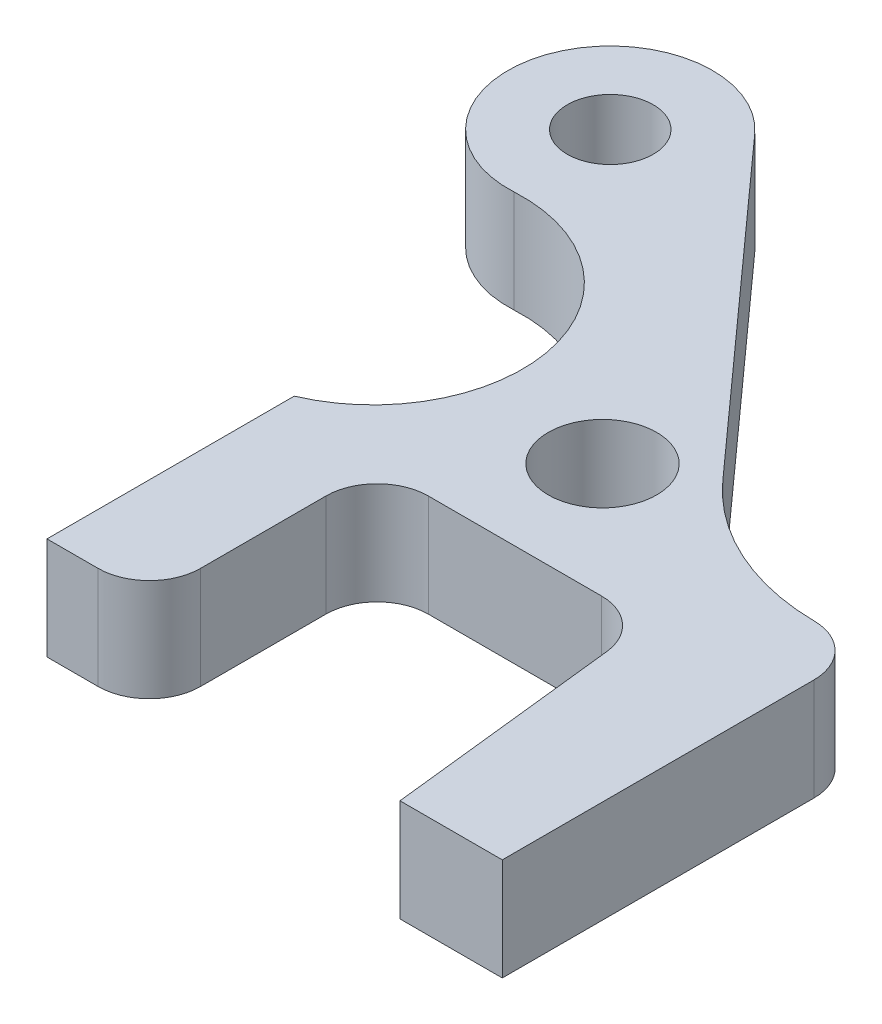
from build123d import *

# Parameters (mm, degrees)
BOSS_EXTRUDE1_DEPTH  = 5
M5_CLEARANCE_HOLE1_D = 5.3
M5_TAPPED_HOLE1_D    = 4.2


with BuildPart() as part:
    # Sketch3 → Boss-Extrude1 (new body)
    with BuildSketch(Plane(origin=(0, 0, 0), x_dir=(-1, 0, 0), z_dir=(0, 1, 0))):
        with BuildLine():
            Line((-3.718320572, -3.342767136), (-17.618374366, 12.118930874))
            ThreePointArc((-17.618374366, 12.118930874), (-21.319064477, 14.826224184), (-25.796067121, 15.816674432))
            ThreePointArc((-25.796067121, 15.816674432), (-27.546375819, 16.558322133), (-28.269100189, 18.316528984))
            Line((-28.269100189, 18.316528984), (-28.269100189, 33.544684312))
            Line((-28.269100189, 33.544684312), (-23.269100189, 33.544684312))
            Line((-23.269100189, 33.544684312), (-22.007395686, 22.177884957))
            ThreePointArc((-22.007395686, 22.177884957), (-21.190062528, 20.590961046), (-19.522655818, 19.953688847))
            Line((-19.522655818, 19.953688847), (-11.061691266, 19.953688847))
            ThreePointArc((-11.061691266, 19.953688847), (-9.293924313, 20.685921894), (-8.561691266, 22.453688847))
            Line((-8.561691266, 22.453688847), (-8.561691266, 28.585543669))
            ThreePointArc((-8.561691266, 28.585543669), (-7.829458219, 30.353310622), (-6.061691266, 31.085543669))
            Line((-6.061691266, 31.085543669), (-3.561691266, 31.085543669))
            Line((-3.561691266, 31.085543669), (-3.561691266, 19.005709588))
            ThreePointArc((-3.561691266, 19.005709588), (-7.807339249, 10.626500654), (-0.291809826, 4.991477439))
            ThreePointArc((-0.291809826, 4.991477439), (4.624412894, -1.901264156), (-3.718320572, -3.342767136))
        make_face()
    extrude(amount=-BOSS_EXTRUDE1_DEPTH)

    # M5 Clearance Hole1 (through all)
    with Locations(Plane(origin=(0, 0, 0), x_dir=(-1, 0, 0), z_dir=(0, 1, 0))):
        with Locations((-13.951148511, 14.33057763)):
            Hole(M5_CLEARANCE_HOLE1_D / 2)

    # M5 Tapped Hole1 (through all)
    with Locations(Plane(origin=(0, 0, 0), x_dir=(-1, 0, 0), z_dir=(0, 1, 0))):
        with Locations((0, 0)):
            Hole(M5_TAPPED_HOLE1_D / 2)


solid = part.part
